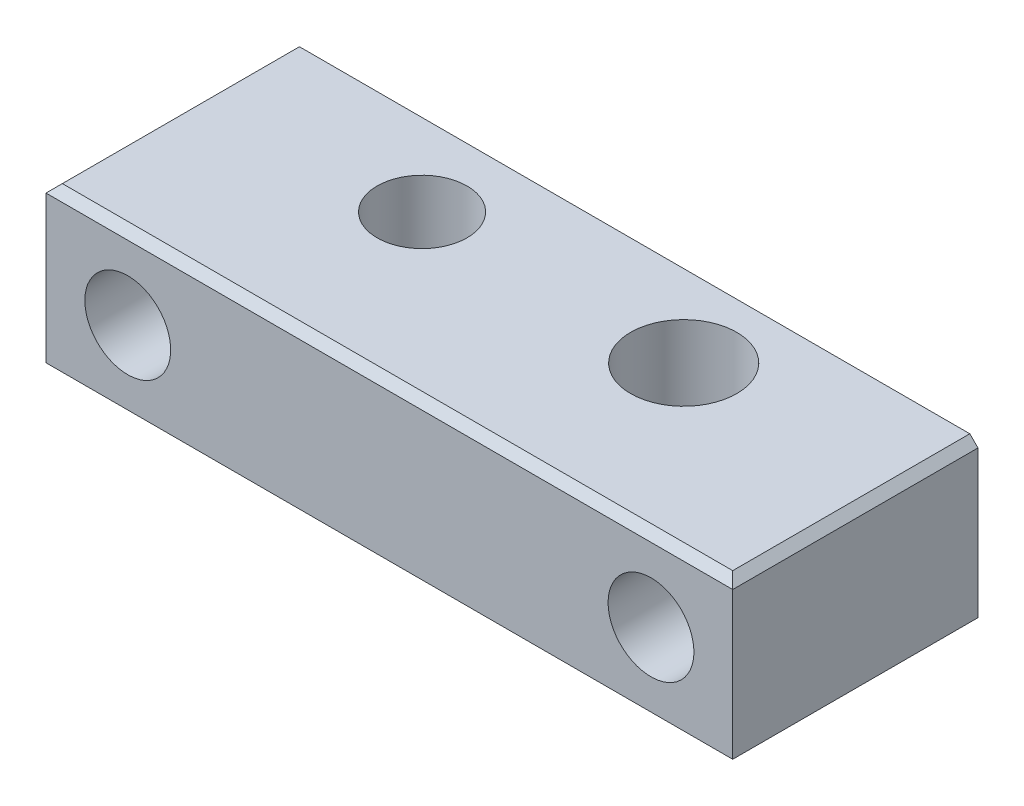
from build123d import *

# Parameters (mm, degrees)
SKETCH1_W                   = 133.35
SKETCH1_H                   = 47.625
BOSS_EXTRUDE1_DEPTH         = 15.8623
CUT_EXTRUDE2_START          = -23.8125
SKETCH2_R                   = 8.3312
CUT_EXTRUDE2_DEPTH          = 133.35
CUT_EXTRUDE4_START          = -23.8125
SKETCH3_R                   = 12.7
CUT_EXTRUDE4_DEPTH          = 15.875
CUT_EXTRUDE6_START          = -15.8623
SKETCH4_R                   = 10.3124
CUT_EXTRUDE6_DEPTH          = 89.417129905
F_3_4_16_TAPPED_HOLE1_D     = 17.4625
F_3_4_16_TAPPED_HOLE1_DEPTH = 31.7246
F_3_4_16_TAPPED_HOLE1_TIP   = 5.24626428
CHAMFER1_SIZE               = 1.5875


with BuildPart() as part:
    # Sketch1 → Boss-Extrude1 (new, symmetric)
    with BuildSketch(Plane(origin=(0, 0, 0), x_dir=(1, 0, 0), z_dir=(0, 1, 0))):
        Rectangle(SKETCH1_W, SKETCH1_H)
    extrude(amount=BOSS_EXTRUDE1_DEPTH, both=True)

    # Sketch2 → Cut-Extrude2 (cut)
    with BuildSketch(Plane.XY.offset(CUT_EXTRUDE2_START)):
        with Locations(Location((-50.8, -0.0127, 0), (0, 0, 180))):
            Circle(SKETCH2_R)
        with Locations(Location((50.8, -0.0127, 0), (0, 0, 180))):
            Circle(SKETCH2_R)
    extrude(amount=CUT_EXTRUDE2_DEPTH, mode=Mode.SUBTRACT)

    # Sketch3 → Cut-Extrude4 (cut)
    with BuildSketch(Plane.XY.offset(CUT_EXTRUDE4_START)):
        with Locations((-50.8, -0.0127)):
            Circle(SKETCH3_R)
        with Locations((50.8, -0.0127)):
            Circle(SKETCH3_R)
    extrude(amount=CUT_EXTRUDE4_DEPTH, mode=Mode.SUBTRACT)

    # Sketch4 → Cut-Extrude6 (cut, through all)
    with BuildSketch(Plane(origin=(0, 0, 0), x_dir=(1, 0, 0), z_dir=(0, 1, 0)).offset(CUT_EXTRUDE6_START)):
        with Locations(Location((25.4, 7.9375, 0), (0, 0, 270))):
            Circle(SKETCH4_R)
    extrude(amount=CUT_EXTRUDE6_DEPTH, mode=Mode.SUBTRACT)

    # 3/4-16 Tapped Hole1
    with Locations(Plane(origin=(0, -15.8623, 0), x_dir=(-1, 0, 0), z_dir=(0, -1, 0))):
        with Locations((25.4, 7.9375)):
            Hole(F_3_4_16_TAPPED_HOLE1_D / 2, depth=F_3_4_16_TAPPED_HOLE1_DEPTH)
            with Locations((0, 0, -(F_3_4_16_TAPPED_HOLE1_DEPTH + F_3_4_16_TAPPED_HOLE1_TIP / 2))):  # 118° drill point
                Cone(0, F_3_4_16_TAPPED_HOLE1_D / 2, F_3_4_16_TAPPED_HOLE1_TIP, mode=Mode.SUBTRACT)

    # Chamfer1
    chamfer1_edges = [part.edges().sort_by_distance(p)[0] for p in [
        (-66.675, 15.8623, 0),
        (0, 15.8623, 23.8125),
        (66.675, 15.8623, 0),
        (0, -15.8623, 23.8125),
        (-66.675, -15.8623, 0),
        (66.675, -15.8623, 0),
    ]]
    chamfer(chamfer1_edges, length=CHAMFER1_SIZE)


solid = part.part
